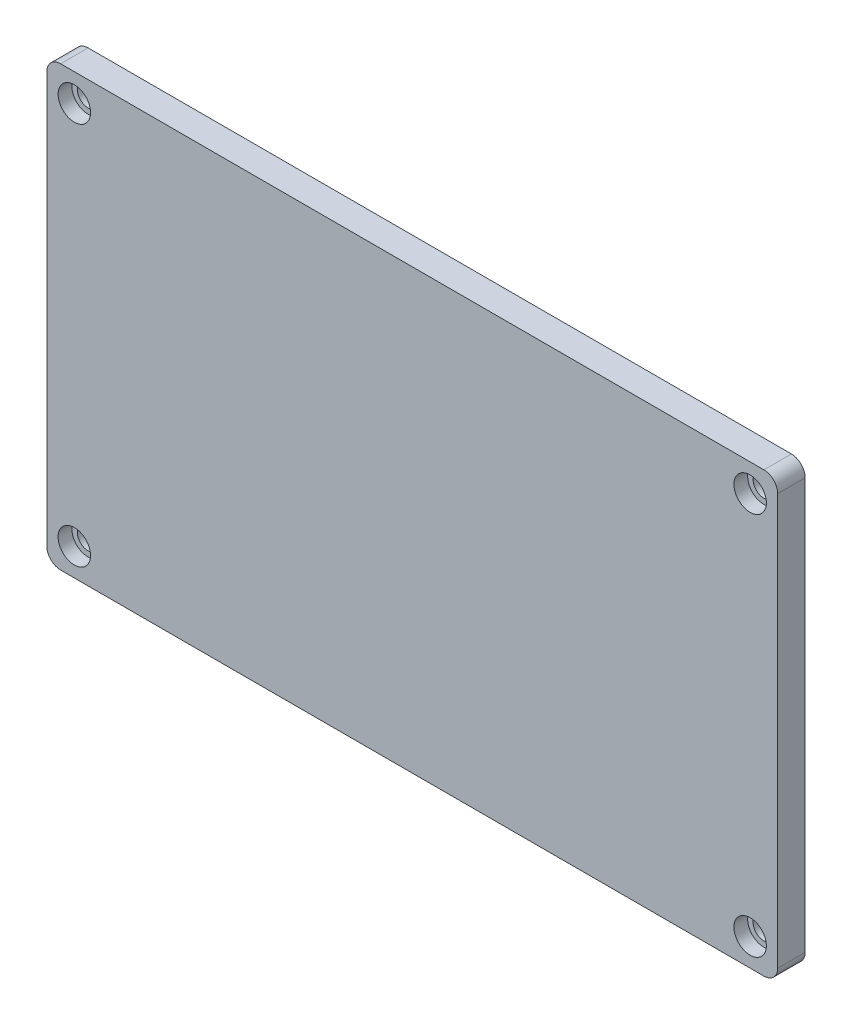
from build123d import *

# Parameters (mm, degrees)
SKETCH1_R           = 2
SKETCH1_W           = 2.5
SKETCH1_H           = 2.794
BOSS_EXTRUDE1_DEPTH = 2.54
SKETCH3_R           = 3
BOSS_EXTRUDE2_DEPTH = 2.54


with BuildPart() as part:
    # Sketch1 → Boss-Extrude1 (new body)
    # profile 1 of 3: a face of its own
    with BuildSketch(Plane.XY):
        with BuildLine():
            Line((-71.901625411, 70.228037055), (-71.901625411, 23.565037055))
            Line((-71.901625411, 23.565037055), (-69.401625411, 23.565037055))
            Line((-69.401625411, 23.565037055), (-69.401625411, 55.378037055))
            ThreePointArc((-69.401625411, 55.378037055), (-66.797804696, 61.66421634), (-60.511625411, 64.268037055))
            Line((-60.511625411, 64.268037055), (26.708374589, 64.268037055))
            ThreePointArc((26.708374589, 64.268037055), (32.994553874, 61.66421634), (35.598374589, 55.378037055))
            Line((35.598374589, 55.378037055), (35.598374589, 8.158037055))
            ThreePointArc((35.598374589, 8.158037055), (32.994553874, 1.871857771), (26.708374589, -0.731962945))
            Line((26.708374589, -0.731962945), (-60.511625411, -0.731962945))
            ThreePointArc((-60.511625411, -0.731962945), (-66.797804696, 1.871857771), (-69.401625411, 8.158037055))
            Line((-69.401625411, 8.158037055), (-69.401625411, 20.771037055))
            Line((-69.401625411, 20.771037055), (-71.901625411, 20.771037055))
            Line((-71.901625411, 20.771037055), (-71.901625411, -5.691962945))
            ThreePointArc((-71.901625411, -5.691962945), (-71.157676635, -7.488014169), (-69.361625411, -8.231962945))
            Line((-69.361625411, -8.231962945), (60.558374589, -8.231962945))
            ThreePointArc((60.558374589, -8.231962945), (62.354425813, -7.488014169), (63.098374589, -5.691962945))
            Line((63.098374589, -5.691962945), (63.098374589, 70.228037055))
            ThreePointArc((63.098374589, 70.228037055), (62.354425813, 72.024088279), (60.558374589, 72.768037055))
            Line((60.558374589, 72.768037055), (-69.361625411, 72.768037055))
            ThreePointArc((-69.361625411, 72.768037055), (-71.157676635, 72.024088279), (-71.901625411, 70.228037055))
        make_face()
        with Locations((-66.821625411, -3.151962945)):
            Circle(SKETCH1_R, mode=Mode.SUBTRACT)
        with Locations((58.018374589, -3.151962945)):
            Circle(SKETCH1_R, mode=Mode.SUBTRACT)
        with Locations((-66.821625411, 67.688037055)):
            Circle(SKETCH1_R, mode=Mode.SUBTRACT)
        with Locations((58.018374589, 67.688037055)):
            Circle(SKETCH1_R, mode=Mode.SUBTRACT)
    # profile 2 of 3: a face of its own
    with BuildSketch(Plane.XY):
        with Locations((-70.651625411, 22.168037055)):
            Rectangle(SKETCH1_W, SKETCH1_H)
    # profile 3 of 3: a face of its own
    with BuildSketch(Plane.XY):
        with BuildLine():
            Line((-69.401625411, 55.378037055), (-69.401625411, 23.565037055))
            Line((-69.401625411, 23.565037055), (-69.401625411, 20.771037055))
            Line((-69.401625411, 20.771037055), (-69.401625411, 8.158037055))
            ThreePointArc((-69.401625411, 8.158037055), (-66.797804696, 1.871857771), (-60.511625411, -0.731962945))
            Line((-60.511625411, -0.731962945), (26.708374589, -0.731962945))
            ThreePointArc((26.708374589, -0.731962945), (32.994553874, 1.871857771), (35.598374589, 8.158037055))
            Line((35.598374589, 8.158037055), (35.598374589, 55.378037055))
            ThreePointArc((35.598374589, 55.378037055), (32.994553874, 61.66421634), (26.708374589, 64.268037055))
            Line((26.708374589, 64.268037055), (-60.511625411, 64.268037055))
            ThreePointArc((-60.511625411, 64.268037055), (-66.797804696, 61.66421634), (-69.401625411, 55.378037055))
        make_face()
    extrude(amount=BOSS_EXTRUDE1_DEPTH)

    # Sketch3 → Boss-Extrude2 (add)
    with BuildSketch(Plane.XY.offset(2.54)):
        with BuildLine():
            Line((63.098374589, -5.691962945), (63.098374589, 70.228037055))
            ThreePointArc((63.098374589, 70.228037055), (62.354425813, 72.024088279), (60.558374589, 72.768037055))
            Line((60.558374589, 72.768037055), (-69.361625411, 72.768037055))
            ThreePointArc((-69.361625411, 72.768037055), (-71.157676635, 72.024088279), (-71.901625411, 70.228037055))
            Line((-71.901625411, 70.228037055), (-71.901625411, -5.691962945))
            ThreePointArc((-71.901625411, -5.691962945), (-71.157676635, -7.488014169), (-69.361625411, -8.231962945))
            Line((-69.361625411, -8.231962945), (60.558374589, -8.231962945))
            ThreePointArc((60.558374589, -8.231962945), (62.354425813, -7.488014169), (63.098374589, -5.691962945))
        make_face()
        with Locations((-66.821625411, -3.151962945)):
            Circle(SKETCH3_R, mode=Mode.SUBTRACT)
        with Locations((58.018374589, -3.151962945)):
            Circle(SKETCH3_R, mode=Mode.SUBTRACT)
        with Locations((58.018374589, 67.688037055)):
            Circle(SKETCH3_R, mode=Mode.SUBTRACT)
        with Locations((-66.821625411, 67.688037055)):
            Circle(SKETCH3_R, mode=Mode.SUBTRACT)
    extrude(amount=BOSS_EXTRUDE2_DEPTH)


solid = part.part
